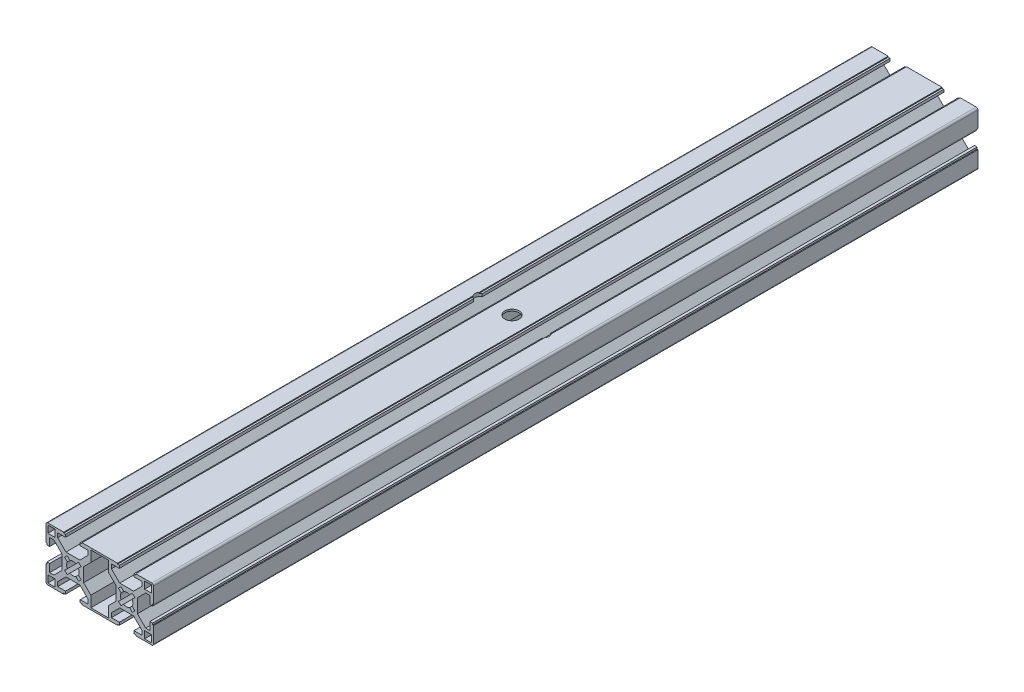
from build123d import *

# Parameters (mm, degrees)
ESBO_O1_W                      = 4
ESBO_O1_H                      = 4
RESSALTO_EXTRUS_O1_DEPTH       = 460
PADR_OCIRCULAR1_COUNT          = 4
PADR_O_LINEAR1_COUNT           = 2
PADR_O_LINEAR1_PITCH           = 30
PADR_O_LINEAR1_COPY_1_SKETCH_W = 4
PADR_O_LINEAR1_COPY_1_SKETCH_H = 4
PADR_O_LINEAR1_COPY_1_DEPTH    = 460
PADR_O_LINEAR1_COPY_2_SKETCH_W = 4
PADR_O_LINEAR1_COPY_2_SKETCH_H = 4
PADR_O_LINEAR1_COPY_2_DEPTH    = 460
PADR_O_LINEAR1_COPY_3_SKETCH_W = 4
PADR_O_LINEAR1_COPY_3_SKETCH_H = 4
PADR_O_LINEAR1_COPY_3_DEPTH    = 460
ESBO_O4_W                      = 10
ESBO_O4_H                      = 28
CORTE_EXTRUS_O1_DEPTH          = 463.439185191
FILETE1_R                      = 1
ESBO_O5_R                      = 4
CORTE_EXTRUS_O2_DEPTH          = 10
SKETCH2_R                      = 2.5
CUT_EXTRUDE1_DEPTH             = 3


with BuildPart() as part:
    # Esboço1 → Ressalto-extrusão1 (new body)
    with BuildSketch(Plane.XY):
        with BuildLine():
            ThreePointArc((-1.664601464, 3.078815026), (-0.858529967, 3.393070335), (0, 3.5))
            Line((0, 3.5), (0, 6))
            Line((0, 6), (-3.878679656, 6))
            Line((-3.878679656, 6), (-8.5, 10.621320344))
            Line((-8.5, 10.621320344), (-8.5, 13))
            Line((-8.5, 13), (-4.1, 13))
            Line((-4.1, 13), (-4.1, 14.5))
            Line((-4.1, 14.5), (-5.1, 14.5))
            Line((-5.1, 14.5), (-5.1, 15))
            Line((-5.1, 15), (-15, 15))
            Line((-15, 15), (-15, 5.1))
            Line((-15, 5.1), (-14.5, 5.1))
            Line((-14.5, 5.1), (-14.5, 4.1))
            Line((-14.5, 4.1), (-13, 4.1))
            Line((-13, 4.1), (-13, 8.5))
            Line((-13, 8.5), (-10.621320344, 8.5))
            Line((-10.621320344, 8.5), (-6, 3.878679656))
            Line((-6, 3.878679656), (-6, 0))
            Line((-6, 0), (-3.5, 0))
            ThreePointArc((-3.5, 0), (-3.393070335, 0.858529967), (-3.078815026, 1.664601464))
            Line((-3.078815026, 1.664601464), (-4.596194078, 3.181980515))
            Line((-4.596194078, 3.181980515), (-3.181980515, 4.596194078))
            Line((-3.181980515, 4.596194078), (-1.664601464, 3.078815026))
        make_face()
        with Locations((-12, 12)):
            Rectangle(ESBO_O1_W, ESBO_O1_H, mode=Mode.SUBTRACT)
    ressalto_extrus_o1 = extrude(amount=RESSALTO_EXTRUS_O1_DEPTH)

    # PadrãoCircular1: Ressalto-extrusão1 ×4 about axis
    padr_ocircular1_axis = Axis((0, 0, 0), (0, 0, 1))
    for i in range(1, PADR_OCIRCULAR1_COUNT):
        add(ressalto_extrus_o1.rotate(padr_ocircular1_axis, i * 360 / PADR_OCIRCULAR1_COUNT))

    # Padrão linear1: Ressalto-extrusão1 ×2
    with Locations(*[(i * PADR_O_LINEAR1_PITCH, 0, 0) for i in range(1, PADR_O_LINEAR1_COUNT)]):
        add(ressalto_extrus_o1)

    # Padrão linear1 copy 1 sketch → Padrão linear1 copy 1 (add)
    with BuildSketch(Plane(origin=(30, 0, 0), x_dir=(0, 1, 0), z_dir=(0, 0, 1))):
        with BuildLine():
            ThreePointArc((-1.664601464, 3.078815026), (-0.858529967, 3.393070335), (0, 3.5))
            Line((0, 3.5), (0, 6))
            Line((0, 6), (-3.878679656, 6))
            Line((-3.878679656, 6), (-8.5, 10.621320344))
            Line((-8.5, 10.621320344), (-8.5, 13))
            Line((-8.5, 13), (-4.1, 13))
            Line((-4.1, 13), (-4.1, 14.5))
            Line((-4.1, 14.5), (-5.1, 14.5))
            Line((-5.1, 14.5), (-5.1, 15))
            Line((-5.1, 15), (-15, 15))
            Line((-15, 15), (-15, 5.1))
            Line((-15, 5.1), (-14.5, 5.1))
            Line((-14.5, 5.1), (-14.5, 4.1))
            Line((-14.5, 4.1), (-13, 4.1))
            Line((-13, 4.1), (-13, 8.5))
            Line((-13, 8.5), (-10.621320344, 8.5))
            Line((-10.621320344, 8.5), (-6, 3.878679656))
            Line((-6, 3.878679656), (-6, 0))
            Line((-6, 0), (-3.5, 0))
            ThreePointArc((-3.5, 0), (-3.393070335, 0.858529967), (-3.078815026, 1.664601464))
            Line((-3.078815026, 1.664601464), (-4.596194078, 3.181980515))
            Line((-4.596194078, 3.181980515), (-3.181980515, 4.596194078))
            Line((-3.181980515, 4.596194078), (-1.664601464, 3.078815026))
        make_face()
        with Locations((-12, 12)):
            Rectangle(PADR_O_LINEAR1_COPY_1_SKETCH_W, PADR_O_LINEAR1_COPY_1_SKETCH_H, mode=Mode.SUBTRACT)
    extrude(amount=PADR_O_LINEAR1_COPY_1_DEPTH)

    # Padrão linear1 copy 2 sketch → Padrão linear1 copy 2 (add)
    with BuildSketch(Plane(origin=(30, 0, 0), x_dir=(-1, 0, 0), z_dir=(0, 0, 1))):
        with BuildLine():
            ThreePointArc((-1.664601464, 3.078815026), (-0.858529967, 3.393070335), (0, 3.5))
            Line((0, 3.5), (0, 6))
            Line((0, 6), (-3.878679656, 6))
            Line((-3.878679656, 6), (-8.5, 10.621320344))
            Line((-8.5, 10.621320344), (-8.5, 13))
            Line((-8.5, 13), (-4.1, 13))
            Line((-4.1, 13), (-4.1, 14.5))
            Line((-4.1, 14.5), (-5.1, 14.5))
            Line((-5.1, 14.5), (-5.1, 15))
            Line((-5.1, 15), (-15, 15))
            Line((-15, 15), (-15, 5.1))
            Line((-15, 5.1), (-14.5, 5.1))
            Line((-14.5, 5.1), (-14.5, 4.1))
            Line((-14.5, 4.1), (-13, 4.1))
            Line((-13, 4.1), (-13, 8.5))
            Line((-13, 8.5), (-10.621320344, 8.5))
            Line((-10.621320344, 8.5), (-6, 3.878679656))
            Line((-6, 3.878679656), (-6, 0))
            Line((-6, 0), (-3.5, 0))
            ThreePointArc((-3.5, 0), (-3.393070335, 0.858529967), (-3.078815026, 1.664601464))
            Line((-3.078815026, 1.664601464), (-4.596194078, 3.181980515))
            Line((-4.596194078, 3.181980515), (-3.181980515, 4.596194078))
            Line((-3.181980515, 4.596194078), (-1.664601464, 3.078815026))
        make_face()
        with Locations((-12, 12)):
            Rectangle(PADR_O_LINEAR1_COPY_2_SKETCH_W, PADR_O_LINEAR1_COPY_2_SKETCH_H, mode=Mode.SUBTRACT)
    extrude(amount=PADR_O_LINEAR1_COPY_2_DEPTH)

    # Padrão linear1 copy 3 sketch → Padrão linear1 copy 3 (add)
    with BuildSketch(Plane(origin=(30, 0, 0), x_dir=(0, -1, 0), z_dir=(0, 0, 1))):
        with BuildLine():
            ThreePointArc((-1.664601464, 3.078815026), (-0.858529967, 3.393070335), (0, 3.5))
            Line((0, 3.5), (0, 6))
            Line((0, 6), (-3.878679656, 6))
            Line((-3.878679656, 6), (-8.5, 10.621320344))
            Line((-8.5, 10.621320344), (-8.5, 13))
            Line((-8.5, 13), (-4.1, 13))
            Line((-4.1, 13), (-4.1, 14.5))
            Line((-4.1, 14.5), (-5.1, 14.5))
            Line((-5.1, 14.5), (-5.1, 15))
            Line((-5.1, 15), (-15, 15))
            Line((-15, 15), (-15, 5.1))
            Line((-15, 5.1), (-14.5, 5.1))
            Line((-14.5, 5.1), (-14.5, 4.1))
            Line((-14.5, 4.1), (-13, 4.1))
            Line((-13, 4.1), (-13, 8.5))
            Line((-13, 8.5), (-10.621320344, 8.5))
            Line((-10.621320344, 8.5), (-6, 3.878679656))
            Line((-6, 3.878679656), (-6, 0))
            Line((-6, 0), (-3.5, 0))
            ThreePointArc((-3.5, 0), (-3.393070335, 0.858529967), (-3.078815026, 1.664601464))
            Line((-3.078815026, 1.664601464), (-4.596194078, 3.181980515))
            Line((-4.596194078, 3.181980515), (-3.181980515, 4.596194078))
            Line((-3.181980515, 4.596194078), (-1.664601464, 3.078815026))
        make_face()
        with Locations((-12, 12)):
            Rectangle(PADR_O_LINEAR1_COPY_3_SKETCH_W, PADR_O_LINEAR1_COPY_3_SKETCH_H, mode=Mode.SUBTRACT)
    extrude(amount=PADR_O_LINEAR1_COPY_3_DEPTH)

    # Esboço4 → Corte-extrusão1 (cut, through all)
    with BuildSketch(Plane(origin=(0, 0, 0), x_dir=(-1, 0, 0), z_dir=(0, 0, -1))):
        with Locations((-15, 0)):
            Rectangle(ESBO_O4_W, ESBO_O4_H)
    extrude(amount=-CORTE_EXTRUS_O1_DEPTH, mode=Mode.SUBTRACT)

    # Filete1
    filete1_edges = [part.edges().sort_by_distance(p)[0] for p in [
        (45, -15, 230),
        (45, 15, 230),
        (-15, 15, 230),
        (-15, -15, 230),
    ]]
    fillet(filete1_edges, radius=FILETE1_R)

    # Esboço5 → Corte-extrusão2 (cut)
    with BuildSketch(Plane(origin=(0, 15, 0), x_dir=(1, 0, 0), z_dir=(0, 1, 0))):
        with Locations(Location((15, -230, 0), (0, 0, 180))):
            Circle(ESBO_O5_R)
    extrude(amount=-CORTE_EXTRUS_O2_DEPTH, mode=Mode.SUBTRACT)

    # Sketch2 → Cut-Extrude1 (cut)
    with BuildSketch(Plane(origin=(0, 15, 0), x_dir=(1, 0, 0), z_dir=(0, 1, 0))):
        with Locations((33.25, -230)):
            Circle(SKETCH2_R)
        with Locations((-3.25, -230)):
            Circle(SKETCH2_R)
    extrude(amount=-CUT_EXTRUDE1_DEPTH, mode=Mode.SUBTRACT)


solid = part.part
